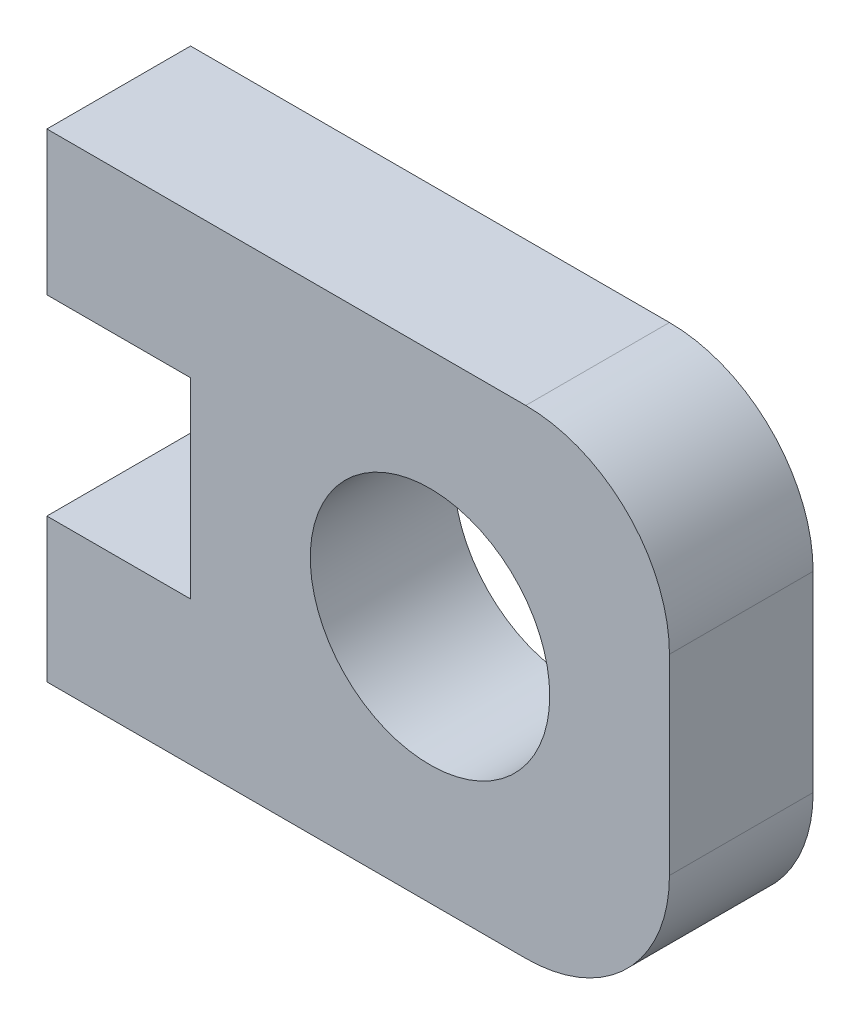
from build123d import *

# Parameters (mm, degrees)
SKETCH1_R           = 2.5
BOSS_EXTRUDE1_DEPTH = 3


with BuildPart() as part:
    # Sketch1 → Boss-Extrude1 (new body)
    with BuildSketch(Plane.XY):
        with BuildLine():
            Line((0, 10), (10, 10))
            ThreePointArc((10, 10), (12.121320344, 9.121320344), (13, 7))
            Line((13, 7), (13, 3))
            ThreePointArc((13, 3), (12.121320344, 0.878679656), (10, 0))
            Line((10, 0), (0, 0))
            Line((0, 0), (0, 3))
            Line((0, 3), (3, 3))
            Line((3, 3), (3, 7))
            Line((3, 7), (0, 7))
            Line((0, 7), (0, 10))
        make_face()
        with Locations((8, 5)):
            Circle(SKETCH1_R, mode=Mode.SUBTRACT)
    extrude(amount=BOSS_EXTRUDE1_DEPTH)


solid = part.part
